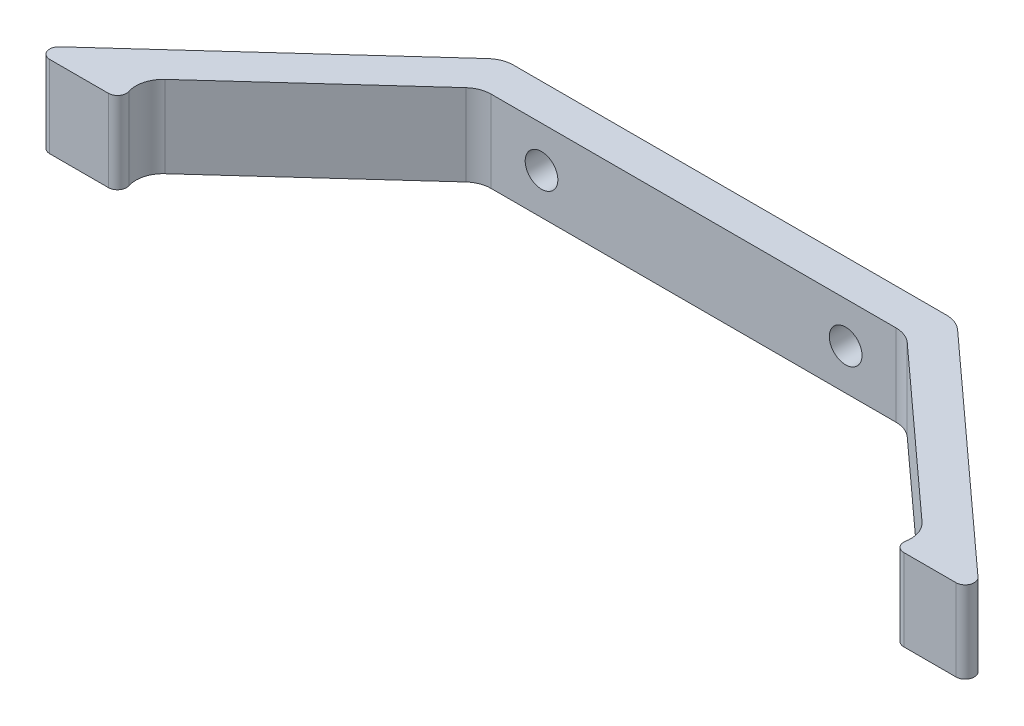
from build123d import *

# Parameters (mm, degrees)
BOSS_EXTRUDE1_DEPTH  = 9
FILLET4_R            = 1
FILLET5_R            = 3
M3_CLEARANCE_HOLE1_D = 3.6


with BuildPart() as part:
    # Sketch1 → Boss-Extrude1 (new body)
    with BuildSketch(Plane(origin=(0, 0, 0), x_dir=(1, 0, 0), z_dir=(0, 1, 0))):
        Polygon((-25, 12.5), (-52.5, -12.5), (-41.5, -12.5), (-43.50199756, -9.725840963), (-23.453572501, 8.5), (23.453572501, 8.5), (44.071371219, -10.24345338), (41.5, -12.5), (52.5, -12.5), (25, 12.5), align=None)
    extrude(amount=BOSS_EXTRUDE1_DEPTH)

    # Fillet4
    fillet4_edges = [part.edges().sort_by_distance(p)[0] for p in [
        (52.5, 4.5, 12.5),
        (41.5, 4.5, 12.5),
        (-41.5, 4.5, 12.5),
        (-52.5, 4.5, 12.5),
    ]]
    fillet(fillet4_edges, radius=FILLET4_R)

    # Fillet5
    fillet5_edges = [part.edges().sort_by_distance(p)[0] for p in [
        (44.071371219, 4.5, 10.24345338),
        (25, 4.5, -12.5),
        (23.453572501, 4.5, -8.5),
        (-23.453572501, 4.5, -8.5),
        (-25, 4.5, -12.5),
        (-43.50199756, 4.5, 9.725840963),
    ]]
    fillet(fillet5_edges, radius=FILLET5_R)

    # M3 Clearance Hole1 (through all)
    with Locations(Plane.XY.offset(-8.5)):
        with Locations((-16.75, 4.5), (16.75, 4.5)):
            Hole(M3_CLEARANCE_HOLE1_D / 2)


solid = part.part
